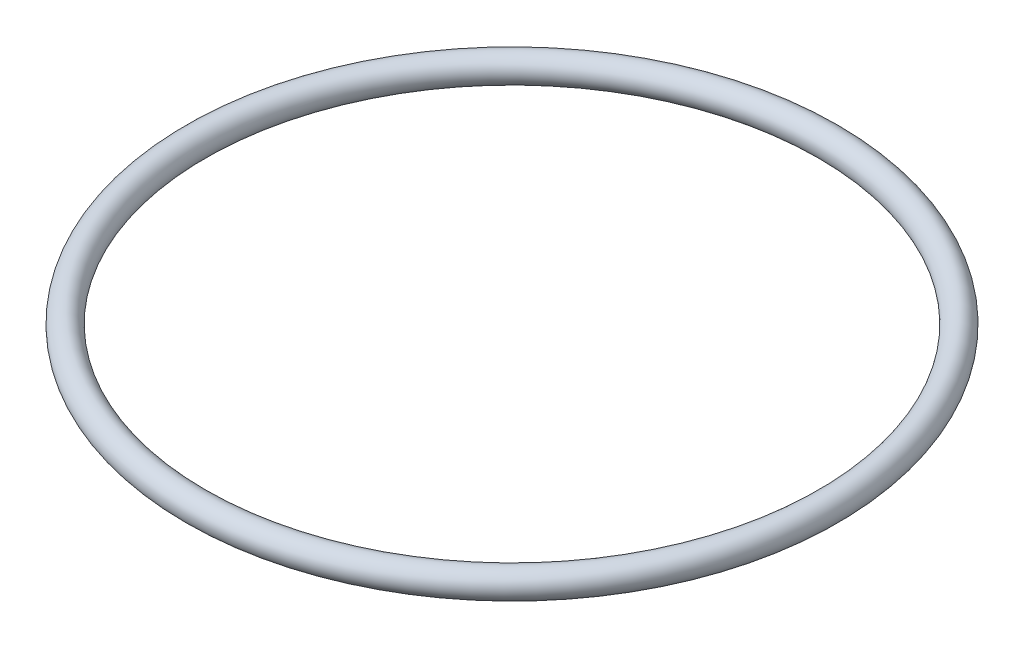
from build123d import *

# Parameters (mm, degrees)
SKETCH1_R = 1.5875


with BuildPart() as part:
    # Sketch1 → Revolve1 (revolve)
    with BuildSketch(Plane.XY, mode=Mode.PRIVATE) as revolve1_sk:
        with Locations((-37.10305, 0)):
            Circle(SKETCH1_R)
    revolve(revolve1_sk.sketch.rotate(Axis((0, 0, 0), (0, 1, 0)), 270), axis=Axis((0, 0, 0), (0, 1, 0)))


solid = part.part
